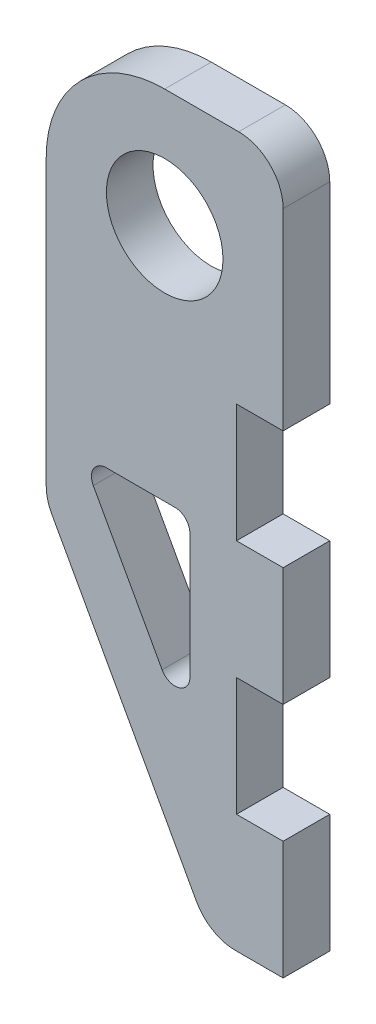
from build123d import *

# Parameters (mm, degrees)
SKETCH1_R           = 5
BOSS_EXTRUDE2_DEPTH = 4
CUT_EXTRUDE1_REACH  = 53.96


with BuildPart() as part:
    # Sketch1 → Boss-Extrude2 (new body)
    with BuildSketch(Plane.XY):
        with BuildLine():
            Line((10.16, 6.35), (10.16, -10.16))
            Line((10.16, -10.16), (6.16, -10.16))
            Line((6.16, -10.16), (6.16, -20.32))
            Line((6.16, -20.32), (10.16, -20.32))
            Line((10.16, -20.32), (10.16, -30.48))
            Line((10.16, -30.48), (6.16, -30.48))
            Line((6.16, -30.48), (6.16, -40.64))
            Line((6.16, -40.64), (10.16, -40.64))
            Line((10.16, -40.64), (10.16, -50.8))
            Line((10.16, -50.8), (6.062743352, -50.8))
            ThreePointArc((6.062743352, -50.8), (4.123604466, -50.269609791), (2.72436074, -48.826110437))
            Line((2.72436074, -48.826110437), (-9.688382612, -26.25748616))
            ThreePointArc((-9.688382612, -26.25748616), (-10.040212579, -25.36923179), (-10.16, -24.421375723))
            Line((-10.16, -24.421375723), (-10.16, 0))
            ThreePointArc((-10.16, 0), (-7.184204897, 7.184204897), (0, 10.16))
            Line((0, 10.16), (6.35, 10.16))
            ThreePointArc((6.35, 10.16), (9.044076836, 9.044076836), (10.16, 6.35))
        make_face()
        Circle(SKETCH1_R, mode=Mode.SUBTRACT)
    extrude(amount=BOSS_EXTRUDE2_DEPTH)

    # Sketch2 → Cut-Extrude1 (cut, up to next)
    with BuildSketch(Plane.XY.offset(4), mode=Mode.PRIVATE) as cut_extrude1_sk1:
        with BuildLine():
            Line((-6.124879753, -22.361389348), (-0.222794204, -33.092453983))
            ThreePointArc((-0.222794204, -33.092453983), (1.205952022, -33.71048803), (2.16, -32.480417171))
            Line((2.16, -32.480417171), (2.16, -21.749352536))
            ThreePointArc((2.16, -21.749352536), (1.788025612, -20.851326924), (0.89, -20.479352536))
            Line((0.89, -20.479352536), (-5.012085549, -20.479352536))
            ThreePointArc((-5.012085549, -20.479352536), (-6.105288813, -21.102972907), (-6.124879753, -22.361389348))
        make_face()
    cut_extrude1_tool1 = extrude(cut_extrude1_sk1.sketch, amount=-CUT_EXTRUDE1_REACH, mode=Mode.PRIVATE) & part.part
    add(cut_extrude1_tool1.solids().sort_by_distance((-1.019639, -25.736268, 4))[0], mode=Mode.SUBTRACT)


solid = part.part
